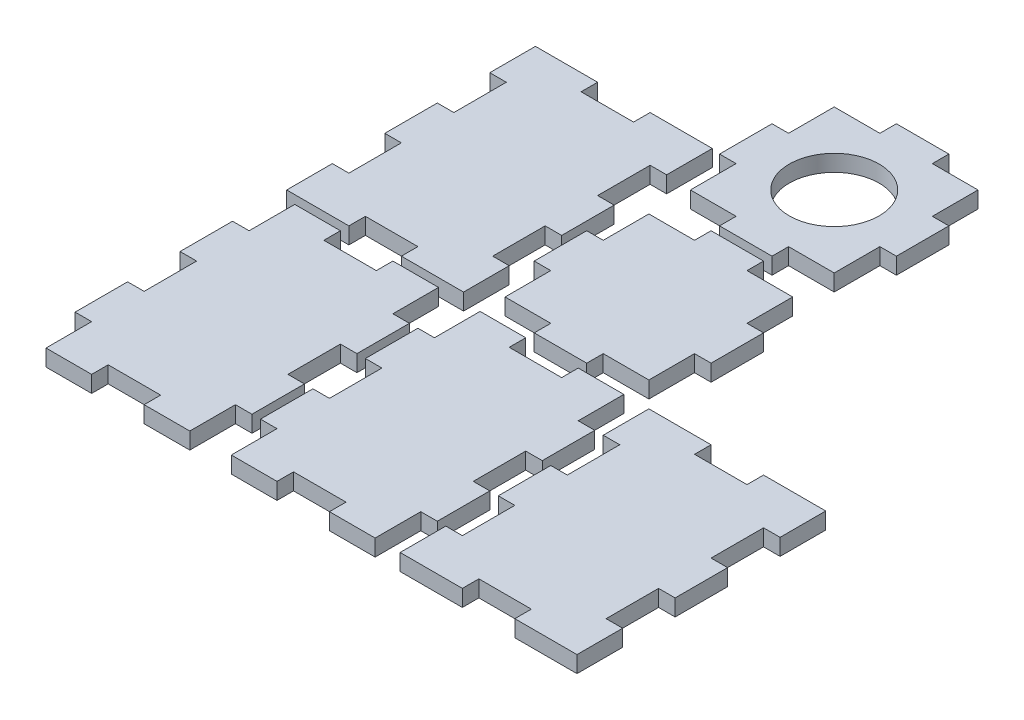
from build123d import *

# Parameters (mm, degrees)
BOSS_EXTRUDE1_DEPTH   = 5.842
BOSS_EXTRUDE1_2_DEPTH = 5.842
BOSS_EXTRUDE1_3_DEPTH = 5.842
BOSS_EXTRUDE1_4_DEPTH = 5.842
BOSS_EXTRUDE1_5_DEPTH = 5.842
BOSS_EXTRUDE1_6_DEPTH = 5.842
SKETCH5_R             = 15.875
CUT_EXTRUDE1_DEPTH    = 297.37611207


with BuildPart() as part:
    # Sketch4 → Boss-Extrude1 (new body)
    with BuildSketch(Plane(origin=(0, 0, 0), x_dir=(1, 0, 0), z_dir=(0, 1, 0))):
        Polygon((43.5102, 181.7624), (43.5102, 175.9204), (24.9682, 175.9204), (24.9682, 181.7624), (8.8392, 181.7624), (2.9972, 181.7624), (2.9972, 175.9204), (2.9972, 165.6334), (8.8392, 165.6334), (8.8392, 147.0914), (2.9972, 147.0914), (2.9972, 128.5494), (8.8392, 128.5494), (8.8392, 110.0074), (2.9972, 110.0074), (2.9972, 99.7204), (2.9972, 93.8784), (8.8392, 93.8784), (24.9682, 93.8784), (24.9682, 99.7204), (43.5102, 99.7204), (43.5102, 93.8784), (59.6392, 93.8784), (65.4812, 93.8784), (65.4812, 99.7204), (65.4812, 110.0074), (59.6392, 110.0074), (59.6392, 128.5494), (65.4812, 128.5494), (65.4812, 147.0914), (59.6392, 147.0914), (59.6392, 165.6334), (65.4812, 165.6334), (65.4812, 175.9204), (65.4812, 181.7624), (59.6392, 181.7624), align=None)
    extrude(amount=BOSS_EXTRUDE1_DEPTH)


with BuildPart() as body_2:
    # Sketch4 → Boss-Extrude1 2 (new body)
    with BuildSketch(Plane(origin=(0, 0, 0), x_dir=(1, 0, 0), z_dir=(0, 1, 0))):
        Polygon((90.4494, 221.8436), (90.4494, 216.0016), (74.3204, 216.0016), (74.3204, 199.8726), (68.4784, 199.8726), (68.4784, 181.3306), (74.3204, 181.3306), (74.3204, 165.2016), (90.4494, 165.2016), (90.4494, 159.3596), (108.9914, 159.3596), (108.9914, 165.2016), (125.1204, 165.2016), (125.1204, 181.3306), (130.9624, 181.3306), (130.9624, 199.8726), (125.1204, 199.8726), (125.1204, 216.0016), (108.9914, 216.0016), (108.9914, 221.8436), align=None)
    extrude(amount=BOSS_EXTRUDE1_2_DEPTH)

    # Sketch5 → Cut-Extrude1 (cut, through all)
    with BuildSketch(Plane(origin=(0, 5.842, 0), x_dir=(1, 0, 0), z_dir=(0, 1, 0))):
        with Locations((99.7204, 190.6016)):
            Circle(SKETCH5_R)
    extrude(amount=-CUT_EXTRUDE1_DEPTH, mode=Mode.SUBTRACT)


with BuildPart() as body_3:
    # Sketch4 → Boss-Extrude1 3 (new body)
    with BuildSketch(Plane(origin=(0, 0, 0), x_dir=(1, 0, 0), z_dir=(0, 1, 0))):
        Polygon((90.4494, 156.3624), (90.4494, 150.5204), (74.3204, 150.5204), (74.3204, 134.3914), (68.4784, 134.3914), (68.4784, 115.8494), (74.3204, 115.8494), (74.3204, 99.7204), (90.4494, 99.7204), (90.4494, 93.8784), (108.9914, 93.8784), (108.9914, 99.7204), (125.1204, 99.7204), (125.1204, 115.8494), (130.9624, 115.8494), (130.9624, 134.3914), (125.1204, 134.3914), (125.1204, 150.5204), (108.9914, 150.5204), (108.9914, 156.3624), align=None)
    extrude(amount=BOSS_EXTRUDE1_3_DEPTH)


with BuildPart() as body_4:
    # Sketch4 → Boss-Extrude1 4 (new body)
    with BuildSketch(Plane(origin=(0, 0, 0), x_dir=(1, 0, 0), z_dir=(0, 1, 0))):
        Polygon((43.5102, 90.8812), (43.5102, 85.0392), (24.9682, 85.0392), (24.9682, 90.8812), (8.8392, 90.8812), (8.8392, 85.0392), (8.8392, 74.7522), (2.9972, 74.7522), (2.9972, 56.2102), (8.8392, 56.2102), (8.8392, 37.6682), (2.9972, 37.6682), (2.9972, 19.1262), (8.8392, 19.1262), (8.8392, 8.8392), (8.8392, 2.9972), (24.9682, 2.9972), (24.9682, 8.8392), (43.5102, 8.8392), (43.5102, 2.9972), (59.6392, 2.9972), (59.6392, 8.8392), (59.6392, 19.1262), (65.4812, 19.1262), (65.4812, 37.6682), (59.6392, 37.6682), (59.6392, 56.2102), (65.4812, 56.2102), (65.4812, 74.7522), (59.6392, 74.7522), (59.6392, 85.0392), (59.6392, 90.8812), align=None)
    extrude(amount=BOSS_EXTRUDE1_4_DEPTH)


with BuildPart() as body_5:
    # Sketch4 → Boss-Extrude1 5 (new body)
    with BuildSketch(Plane(origin=(0, 0, 0), x_dir=(1, 0, 0), z_dir=(0, 1, 0))):
        Polygon((90.4494, 85.0392), (90.4494, 90.8812), (74.3204, 90.8812), (74.3204, 85.0392), (74.3204, 74.7522), (68.4784, 74.7522), (68.4784, 56.2102), (74.3204, 56.2102), (74.3204, 37.6682), (68.4784, 37.6682), (68.4784, 19.1262), (74.3204, 19.1262), (74.3204, 8.8392), (74.3204, 2.9972), (90.4494, 2.9972), (90.4494, 8.8392), (108.9914, 8.8392), (108.9914, 2.9972), (125.1204, 2.9972), (125.1204, 8.8392), (125.1204, 19.1262), (130.9624, 19.1262), (130.9624, 37.6682), (125.1204, 37.6682), (125.1204, 56.2102), (130.9624, 56.2102), (130.9624, 74.7522), (125.1204, 74.7522), (125.1204, 85.0392), (125.1204, 90.8812), (108.9914, 90.8812), (108.9914, 85.0392), align=None)
    extrude(amount=BOSS_EXTRUDE1_5_DEPTH)


with BuildPart() as body_6:
    # Sketch4 → Boss-Extrude1 6 (new body)
    with BuildSketch(Plane(origin=(0, 0, 0), x_dir=(1, 0, 0), z_dir=(0, 1, 0))):
        Polygon((155.9306, 85.0392), (155.9306, 90.8812), (139.8016, 90.8812), (133.9596, 90.8812), (133.9596, 85.0392), (133.9596, 74.7522), (139.8016, 74.7522), (139.8016, 56.2102), (133.9596, 56.2102), (133.9596, 37.6682), (139.8016, 37.6682), (139.8016, 19.1262), (133.9596, 19.1262), (133.9596, 8.8392), (133.9596, 2.9972), (139.8016, 2.9972), (155.9306, 2.9972), (155.9306, 8.8392), (174.4726, 8.8392), (174.4726, 2.9972), (190.6016, 2.9972), (196.4436, 2.9972), (196.4436, 8.8392), (196.4436, 19.1262), (190.6016, 19.1262), (190.6016, 37.6682), (196.4436, 37.6682), (196.4436, 56.2102), (190.6016, 56.2102), (190.6016, 74.7522), (196.4436, 74.7522), (196.4436, 85.0392), (196.4436, 90.8812), (190.6016, 90.8812), (174.4726, 90.8812), (174.4726, 85.0392), align=None)
    extrude(amount=BOSS_EXTRUDE1_6_DEPTH)


solid = Compound([part.part, body_2.part, body_3.part, body_4.part, body_5.part, body_6.part])
